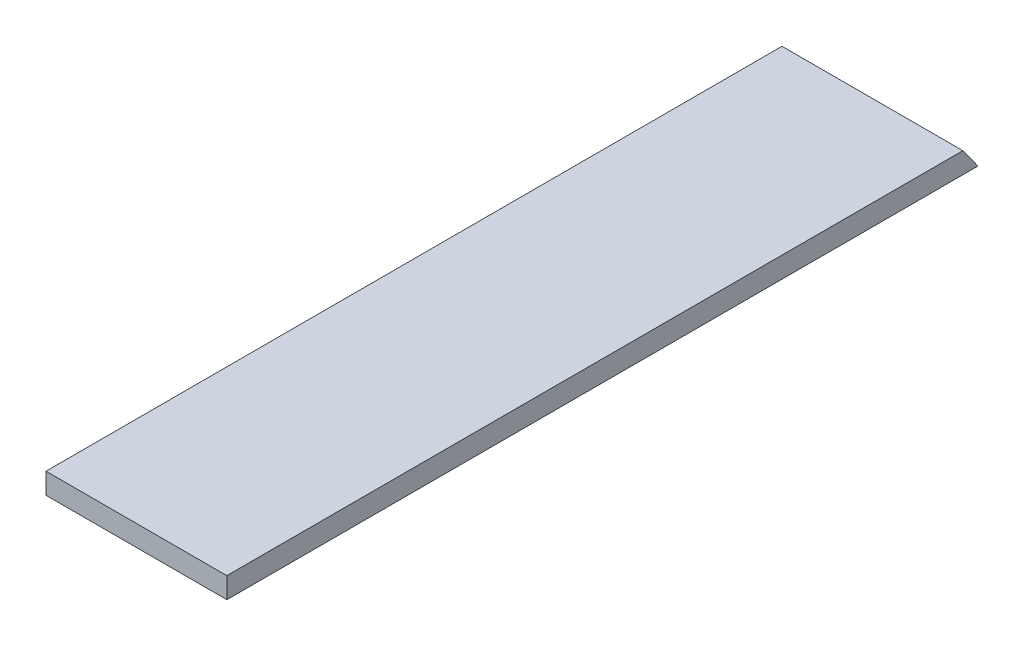
from build123d import *

# Parameters (mm, degrees)
EXTRUDE_1_DEPTH = 26


with BuildPart() as part:
    # Эскиз1 → Бобышка-Вытянуть1 (new body)
    with BuildSketch(Plane(origin=(0, 0, 0), x_dir=(0, 0, -1), z_dir=(1, 0, 0))):
        Polygon((54, 0), (-54, 0), (-54, 3), (51.820372416, 3), align=None)
    extrude(amount=EXTRUDE_1_DEPTH)


solid = part.part
